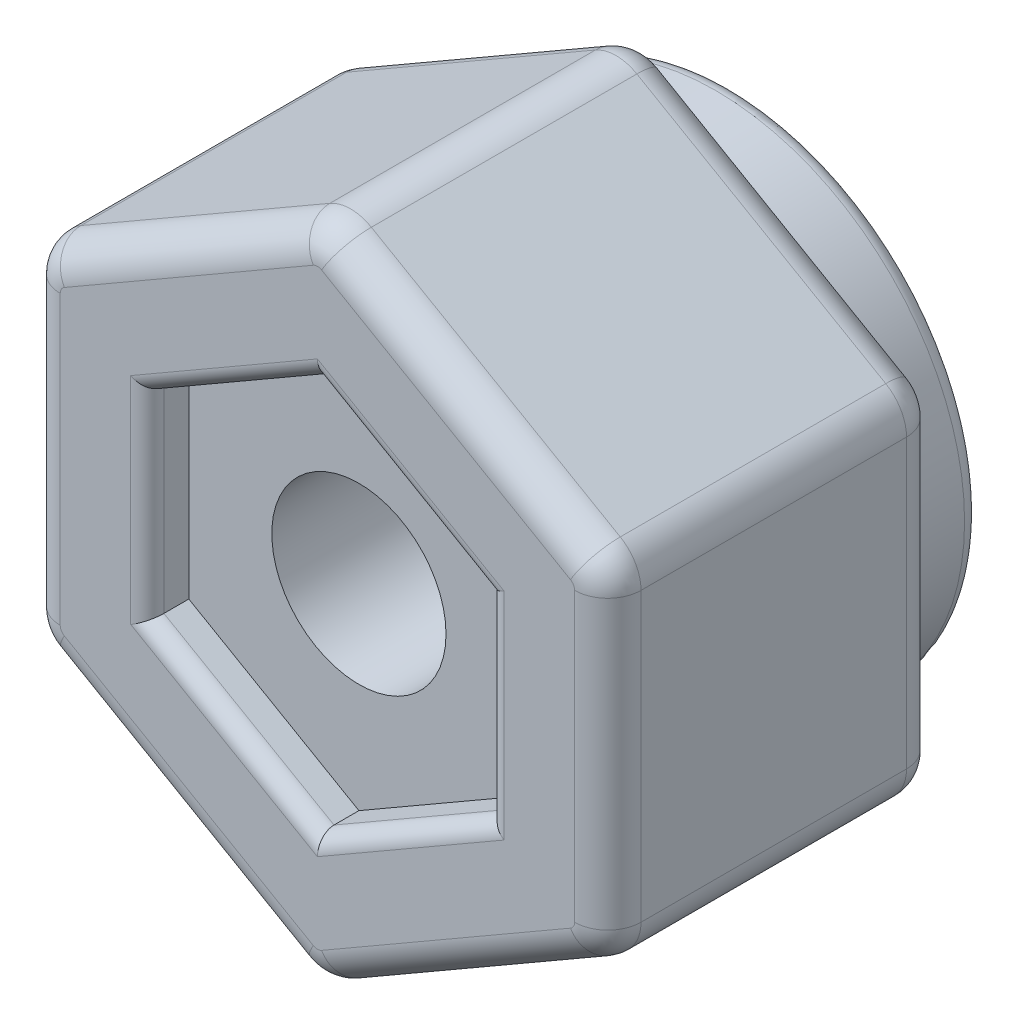
from build123d import *

# Parameters (mm, degrees)
BOSS_EXTRUDE1_DEPTH = 8
CUT_EXTRUDE1_DEPTH  = 1
SKETCH3_R           = 2.1
CUT_EXTRUDE2_DEPTH  = 5
FILLET1_R           = 1
FILLET2_R           = 0.8
FILLET3_R           = 0.4
SKETCH4_R           = 6
SKETCH4_R_2         = 2.1
BOSS_EXTRUDE2_DEPTH = 2
FILLET4_R           = 0.4
SKETCH5_R           = 2.1
BOSS_EXTRUDE3_DEPTH = 0.4
SKETCH6_R           = 2.1
CUT_EXTRUDE3_DEPTH  = 14.88727504


with BuildPart() as part:
    # Sketch1 → Boss-Extrude1 (new body)
    with BuildSketch(Plane.XY):
        Polygon((0, 8.082903769), (-7, 4.041451884), (-7, -4.041451884), (0, -8.082903769), (7, -4.041451884), (7, 4.041451884), align=None)
    extrude(amount=BOSS_EXTRUDE1_DEPTH)

    # Sketch2 → Cut-Extrude1 (cut)
    with BuildSketch(Plane.XY.offset(8)):
        Polygon((0, 4.734272207), (-4.1, 2.367136104), (-4.1, -2.367136104), (0, -4.734272207), (4.1, -2.367136104), (4.1, 2.367136104), align=None)
    extrude(amount=-CUT_EXTRUDE1_DEPTH, mode=Mode.SUBTRACT)

    # Sketch3 → Cut-Extrude2 (cut)
    with BuildSketch(Plane.XY.offset(7)):
        Circle(SKETCH3_R)
    extrude(amount=-CUT_EXTRUDE2_DEPTH, mode=Mode.SUBTRACT)

    # Fillet1
    fillet1_edges = [part.edges().sort_by_distance(p)[0] for p in [
        (7, 4.041451884, 4),
        (7, -4.041451884, 4),
        (0, -8.082903769, 4),
        (-7, -4.041451884, 4),
        (-7, 4.041451884, 4),
        (0, 8.082903769, 4),
    ]]
    fillet(fillet1_edges, radius=FILLET1_R)

    # Fillet2
    fillet2_edges = [part.edges().sort_by_distance(p)[0] for p in [
        (7, 0, 0),
        (7, 0, 8),
        (3.5, 6.062177826, 0),
        (3.5, -6.062177826, 0),
        (-3.5, -6.062177826, 0),
        (-7, 0, 0),
        (-3.5, 6.062177826, 0),
        (6.866025404, 3.964101615, 0),
        (0, 7.92820323, 0),
        (-6.866025404, 3.964101615, 0),
        (-6.866025404, -3.964101615, 0),
        (0, -7.92820323, 0),
        (6.866025404, -3.964101615, 0),
        (3.5, -6.062177826, 8),
        (3.5, 6.062177826, 8),
        (-3.5, 6.062177826, 8),
        (-7, 0, 8),
        (-3.5, -6.062177826, 8),
        (6.866025404, 3.964101615, 8),
        (0, 7.92820323, 8),
        (-6.866025404, 3.964101615, 8),
        (-6.866025404, -3.964101615, 8),
        (0, -7.92820323, 8),
        (6.866025404, -3.964101615, 8),
    ]]
    fillet(fillet2_edges, radius=FILLET2_R)

    # Fillet3
    fillet3_edges = [part.edges().sort_by_distance(p)[0] for p in [
        (2.05, 3.550704156, 8),
        (-2.05, 3.550704156, 8),
        (-4.1, 0, 8),
        (-2.05, -3.550704156, 8),
        (2.05, -3.550704156, 8),
        (4.1, 0, 8),
    ]]
    fillet(fillet3_edges, radius=FILLET3_R)

    # Sketch4 → Boss-Extrude2 (add)
    with BuildSketch(Plane(origin=(0, 0, 0), x_dir=(-1, 0, 0), z_dir=(0, 0, -1))):
        with Locations(Location((0, 0, 0), (0, 0, 180))):
            Circle(SKETCH4_R)
        with Locations(Location((0, 0, 0), (0, 0, 180))):
            Circle(SKETCH4_R_2, mode=Mode.SUBTRACT)
    extrude(amount=BOSS_EXTRUDE2_DEPTH)

    # Fillet4
    fillet4_edges = [part.edges().sort_by_distance(p)[0] for p in [
        (-6, 0, -2),
        (-2.1, 0, -2),
    ]]
    fillet(fillet4_edges, radius=FILLET4_R)

    # Sketch5 → Boss-Extrude3 (add)
    with BuildSketch(Plane.XY.offset(7)):
        with Locations(Location((0, 0, 0), (0, 0, 180))):
            Circle(SKETCH5_R)
    extrude(amount=-BOSS_EXTRUDE3_DEPTH)

    # Sketch6 → Cut-Extrude3 (cut, through all)
    with BuildSketch(Plane.XY.offset(7)):
        Circle(SKETCH6_R)
    extrude(amount=-CUT_EXTRUDE3_DEPTH, mode=Mode.SUBTRACT)


solid = part.part
